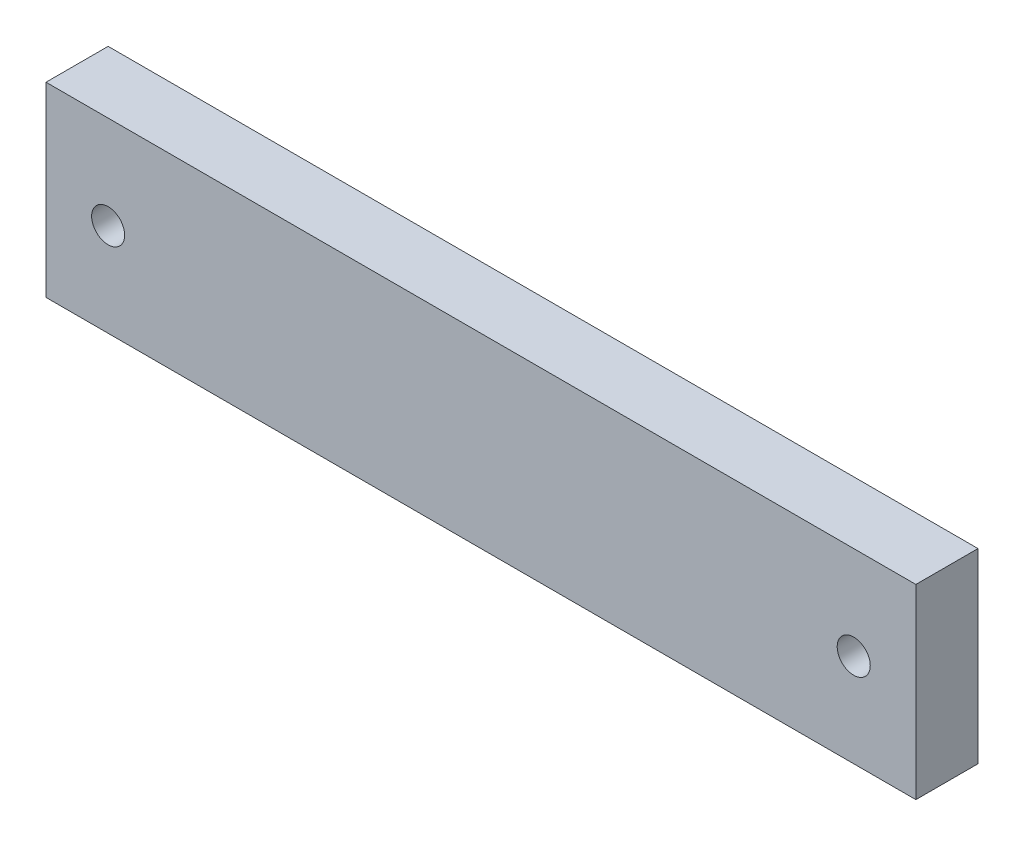
from build123d import *

# Parameters (mm, degrees)
SKETCH1_W               = 177.8
SKETCH1_H               = 38.1
BOSS_EXTRUDE1_DEPTH     = 12.7
F_1_4_CLEARANCE_HOLE1_D = 6.7564


with BuildPart() as part:
    # Sketch1 → Boss-Extrude1 (new body)
    with BuildSketch(Plane.XY):
        with Locations((88.9, 19.05)):
            Rectangle(SKETCH1_W, SKETCH1_H)
    extrude(amount=BOSS_EXTRUDE1_DEPTH)

    # 1/4 Clearance Hole1 (through all)
    with Locations(Plane.XY.offset(12.7)):
        with Locations((12.7, 19.05), (165.1, 19.05)):
            Hole(F_1_4_CLEARANCE_HOLE1_D / 2)


solid = part.part
